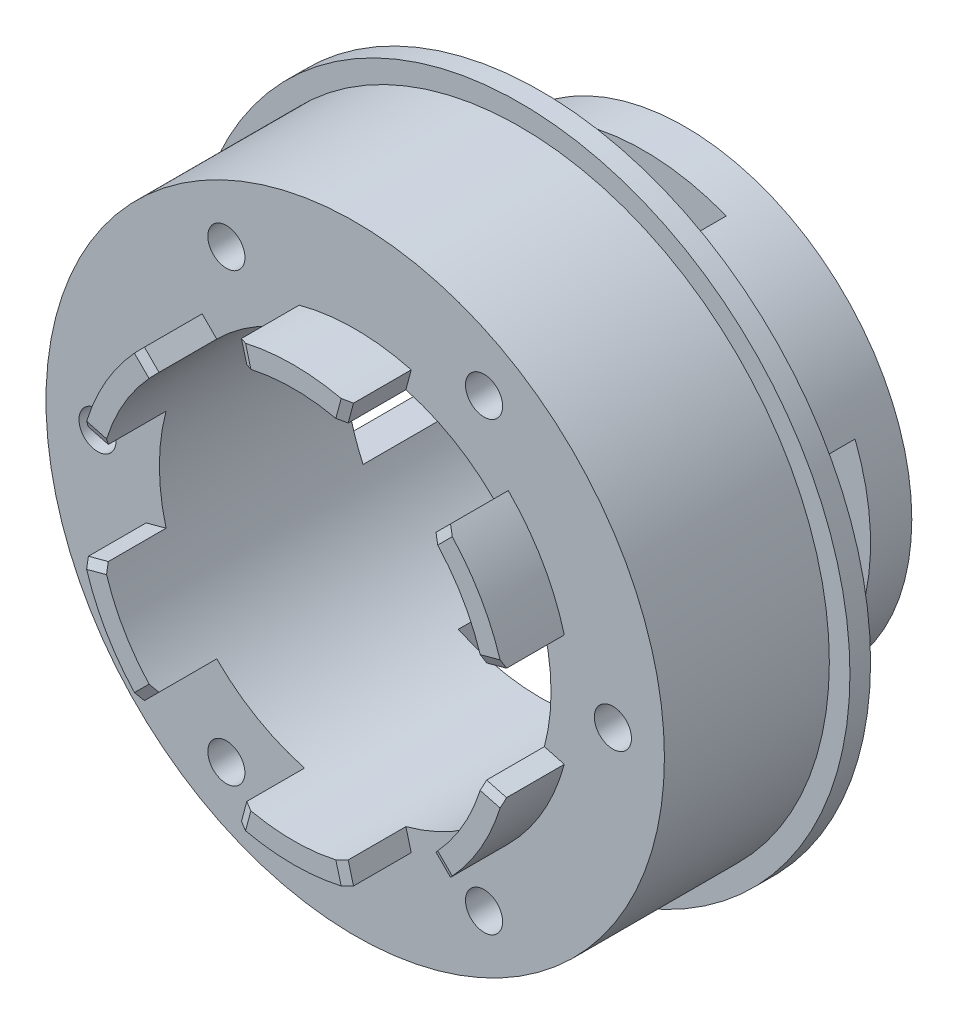
from build123d import *
from OCP.BRepFilletAPI import BRepFilletAPI_MakeChamfer

# Parameters (mm, degrees)
SKETCH_1_R               = 11
EXTRUDE_1_DEPTH          = 2
SKETCH_2_R               = 11
SKETCH_2_R_2             = 9.5
EXTRUDE_2_DEPTH          = 5
SKETCH_4_R               = 16
SKETCH_4_R_2             = 9.5
EXTRUDE_3_DEPTH          = 1
SKETCH_5_R               = 15
SKETCH_5_R_2             = 9.5
EXTRUDE_4_DEPTH          = 8
SKETCH_6_R               = 0.9
CUT_EXTRUDE_1_DEPTH      = 8
SKETCH_7_R               = 3
SKETCH_7_R_2             = 1
CUT_EXTRUDE_2_DEPTH      = 28.712812921
CUT_EXTRUDE_3_DEPTH      = 28.712812921
CUT_EXTRUDE_3_DEPTH_BACK = 28.712812921
SKETCH_8_W               = 8
SKETCH_8_H               = 5
CUT_EXTRUDE_4_DEPTH      = 28.712812921
CUT_EXTRUDE_4_DEPTH_BACK = 28.712812921
SKETCH_9_W               = 5
SKETCH_9_H               = 8
EXTRUDE_5_DEPTH          = 3
CHAMFER_1_SIZE           = 0.2
CHAMFER_1_SIZE2          = 0.410060768


with BuildPart() as part:
    # 스케치1 → 보스-돌출1 (new body)
    with BuildSketch(Plane.XY):
        Circle(SKETCH_1_R)
    extrude(amount=EXTRUDE_1_DEPTH)

    # 스케치2 → 보스-돌출2 (add)
    with BuildSketch(Plane.XY.offset(2)):
        Circle(SKETCH_2_R)
        Circle(SKETCH_2_R_2, mode=Mode.SUBTRACT)
    extrude(amount=EXTRUDE_2_DEPTH)

    # 스케치4 → 보스-돌출3 (add)
    with BuildSketch(Plane.XY.offset(7)):
        Circle(SKETCH_4_R)
        Circle(SKETCH_4_R_2, mode=Mode.SUBTRACT)
    extrude(amount=EXTRUDE_3_DEPTH)

    # 스케치5 → 보스-돌출4 (add)
    with BuildSketch(Plane.XY.offset(8)):
        Circle(SKETCH_5_R)
        Circle(SKETCH_5_R_2, mode=Mode.SUBTRACT)
    extrude(amount=EXTRUDE_4_DEPTH)

    # 스케치6 → 컷-돌출1 (cut)
    with BuildSketch(Plane.XY.offset(16)):
        with Locations((12.5, 0)):
            Circle(SKETCH_6_R)
        with Locations((6.25, -10.825317547)):
            Circle(SKETCH_6_R)
        with Locations((-6.25, -10.825317547)):
            Circle(SKETCH_6_R)
        with Locations((-12.5, 0)):
            Circle(SKETCH_6_R)
        with Locations((-6.25, 10.825317547)):
            Circle(SKETCH_6_R)
        with Locations((6.25, 10.825317547)):
            Circle(SKETCH_6_R)
    extrude(amount=-CUT_EXTRUDE_1_DEPTH, mode=Mode.SUBTRACT)

    # 스케치7 → 컷-돌출2 (cut, through all)
    with BuildSketch(Plane(origin=(0, 0, 0), x_dir=(-1, 0, 0), z_dir=(0, 0, -1))):
        Circle(SKETCH_7_R)
        with Locations((-8, 0)):
            Circle(SKETCH_7_R_2)
        with Locations((8, 0)):
            Circle(SKETCH_7_R_2)
        with Locations((0, 8)):
            Circle(SKETCH_7_R_2)
        with Locations((0, -8)):
            Circle(SKETCH_7_R_2)
    extrude(amount=-CUT_EXTRUDE_2_DEPTH, mode=Mode.SUBTRACT)

    # 스케치8 → 컷-돌출3 (cut, two sides: drawn at the far end of the back side and taken through both)
    with BuildSketch(Plane(origin=(0, 0, 0), x_dir=(1, 0, 0), z_dir=(0, 1, 0)).offset(-CUT_EXTRUDE_3_DEPTH_BACK)):
        with Locations((0, -4.5)):
            Rectangle(SKETCH_8_W, SKETCH_8_H)
    extrude(amount=CUT_EXTRUDE_3_DEPTH + CUT_EXTRUDE_3_DEPTH_BACK, mode=Mode.SUBTRACT)

    # 스케치9 → 컷-돌출4 (cut, two sides: drawn at the far end of the back side and taken through both)
    with BuildSketch(Plane(origin=(0, 0, 0), x_dir=(0, 0, -1), z_dir=(1, 0, 0)).offset(-CUT_EXTRUDE_4_DEPTH_BACK)):
        with Locations((-4.5, 0)):
            Rectangle(SKETCH_9_W, SKETCH_9_H)
    extrude(amount=CUT_EXTRUDE_4_DEPTH + CUT_EXTRUDE_4_DEPTH_BACK, mode=Mode.SUBTRACT)

    # 스케치10 → 보스-돌출5 (add)
    with BuildSketch(Plane.XY.offset(16)):
        with BuildLine():
            Line((2.458780928, 9.17629535), (2.717599974, 10.142221176))
            ThreePointArc((2.717599974, 10.142221176), (0, 10.5), (-2.717599974, 10.142221176))
            Line((-2.717599974, 10.142221176), (-2.458780928, 9.17629535))
            ThreePointArc((-2.458780928, 9.17629535), (0, 9.5), (2.458780928, 9.17629535))
        make_face()
        with BuildLine():
            Line((6.717514421, 6.717514421), (7.424621202, 7.424621202))
            ThreePointArc((7.424621202, 7.424621202), (9.09326674, 5.25), (10.142221176, 2.717599974))
            Line((10.142221176, 2.717599974), (9.17629535, 2.458780928))
            ThreePointArc((9.17629535, 2.458780928), (8.227241336, 4.75), (6.717514421, 6.717514421))
        make_face()
        with BuildLine():
            Line((9.17629535, -2.458780928), (10.142221176, -2.717599974))
            ThreePointArc((10.142221176, -2.717599974), (9.09326674, -5.25), (7.424621202, -7.424621202))
            Line((7.424621202, -7.424621202), (6.717514421, -6.717514421))
            ThreePointArc((6.717514421, -6.717514421), (8.227241336, -4.75), (9.17629535, -2.458780928))
        make_face()
        with BuildLine():
            Line((2.458780928, -9.17629535), (2.717599974, -10.142221176))
            ThreePointArc((2.717599974, -10.142221176), (0, -10.5), (-2.717599974, -10.142221176))
            Line((-2.717599974, -10.142221176), (-2.458780928, -9.17629535))
            ThreePointArc((-2.458780928, -9.17629535), (0, -9.5), (2.458780928, -9.17629535))
        make_face()
        with BuildLine():
            Line((-6.717514421, -6.717514421), (-7.424621202, -7.424621202))
            ThreePointArc((-7.424621202, -7.424621202), (-9.09326674, -5.25), (-10.142221176, -2.717599974))
            Line((-10.142221176, -2.717599974), (-9.17629535, -2.458780928))
            ThreePointArc((-9.17629535, -2.458780928), (-8.227241336, -4.75), (-6.717514421, -6.717514421))
        make_face()
        with BuildLine():
            Line((-9.17629535, 2.458780928), (-10.142221176, 2.717599974))
            ThreePointArc((-10.142221176, 2.717599974), (-9.09326674, 5.25), (-7.424621202, 7.424621202))
            Line((-7.424621202, 7.424621202), (-6.717514421, 6.717514421))
            ThreePointArc((-6.717514421, 6.717514421), (-8.227241336, 4.75), (-9.17629535, 2.458780928))
        make_face()
    extrude(amount=EXTRUDE_5_DEPTH)

    # 모따기1: one chamfer whose edges measure the first distance from different faces: ONE call of the kernel's chamfer builder (chamfer() names one face for all edges)
    chamfer_1_edges_1 = [part.edges().sort_by_distance(p)[0] for p in [
        (-7.071067812, 7.071067812, 19),
    ]]
    chamfer_1_side_1 = [part.faces().sort_by_distance(p)[0] for p in [
        (-7.071067812, 7.071067812, 17.5),
    ]]
    chamfer_1_edges_2 = [part.edges().sort_by_distance(p)[0] for p in [
        (-9.659258263, 2.588190451, 19),
    ]]
    chamfer_1_side_2 = [part.faces().sort_by_distance(p)[0] for p in [
        (-9.659258263, 2.588190451, 17.5),
    ]]
    chamfer_1_edges_3 = [part.edges().sort_by_distance(p)[0] for p in [
        (-9.659258263, -2.588190451, 19),
    ]]
    chamfer_1_side_3 = [part.faces().sort_by_distance(p)[0] for p in [
        (-9.659258263, -2.588190451, 17.5),
    ]]
    chamfer_1_edges_4 = [part.edges().sort_by_distance(p)[0] for p in [
        (-7.071067812, -7.071067812, 19),
    ]]
    chamfer_1_side_4 = [part.faces().sort_by_distance(p)[0] for p in [
        (-7.071067812, -7.071067812, 17.5),
    ]]
    chamfer_1_edges_5 = [part.edges().sort_by_distance(p)[0] for p in [
        (-2.588190451, 9.659258263, 19),
    ]]
    chamfer_1_side_5 = [part.faces().sort_by_distance(p)[0] for p in [
        (-2.588190451, 9.659258263, 17.5),
    ]]
    chamfer_1_edges_6 = [part.edges().sort_by_distance(p)[0] for p in [
        (2.588190451, 9.659258263, 19),
    ]]
    chamfer_1_side_6 = [part.faces().sort_by_distance(p)[0] for p in [
        (2.588190451, 9.659258263, 17.5),
    ]]
    chamfer_1_edges_7 = [part.edges().sort_by_distance(p)[0] for p in [
        (-2.588190451, -9.659258263, 19),
    ]]
    chamfer_1_side_7 = [part.faces().sort_by_distance(p)[0] for p in [
        (-2.588190451, -9.659258263, 17.5),
    ]]
    chamfer_1_edges_8 = [part.edges().sort_by_distance(p)[0] for p in [
        (2.588190451, -9.659258263, 19),
    ]]
    chamfer_1_side_8 = [part.faces().sort_by_distance(p)[0] for p in [
        (2.588190451, -9.659258263, 17.5),
    ]]
    chamfer_1_edges_9 = [part.edges().sort_by_distance(p)[0] for p in [
        (7.071067812, 7.071067812, 19),
    ]]
    chamfer_1_side_9 = [part.faces().sort_by_distance(p)[0] for p in [
        (7.071067812, 7.071067812, 17.5),
    ]]
    chamfer_1_edges_10 = [part.edges().sort_by_distance(p)[0] for p in [
        (9.659258263, 2.588190451, 19),
    ]]
    chamfer_1_side_10 = [part.faces().sort_by_distance(p)[0] for p in [
        (9.659258263, 2.588190451, 17.5),
    ]]
    chamfer_1_edges_11 = [part.edges().sort_by_distance(p)[0] for p in [
        (7.071067812, -7.071067812, 19),
    ]]
    chamfer_1_side_11 = [part.faces().sort_by_distance(p)[0] for p in [
        (7.071067812, -7.071067812, 17.5),
    ]]
    chamfer_1_edges_12 = [part.edges().sort_by_distance(p)[0] for p in [
        (9.659258263, -2.588190451, 19),
    ]]
    chamfer_1_side_12 = [part.faces().sort_by_distance(p)[0] for p in [
        (9.659258263, -2.588190451, 17.5),
    ]]
    chamfer_1 = BRepFilletAPI_MakeChamfer(part.part.solid().wrapped)
    for e in chamfer_1_edges_1:
        chamfer_1.Add(CHAMFER_1_SIZE, CHAMFER_1_SIZE2, e.wrapped, chamfer_1_side_1[0].wrapped)  # the first distance lies on this face
    for e in chamfer_1_edges_2:
        chamfer_1.Add(CHAMFER_1_SIZE, CHAMFER_1_SIZE2, e.wrapped, chamfer_1_side_2[0].wrapped)  # the first distance lies on this face
    for e in chamfer_1_edges_3:
        chamfer_1.Add(CHAMFER_1_SIZE, CHAMFER_1_SIZE2, e.wrapped, chamfer_1_side_3[0].wrapped)  # the first distance lies on this face
    for e in chamfer_1_edges_4:
        chamfer_1.Add(CHAMFER_1_SIZE, CHAMFER_1_SIZE2, e.wrapped, chamfer_1_side_4[0].wrapped)  # the first distance lies on this face
    for e in chamfer_1_edges_5:
        chamfer_1.Add(CHAMFER_1_SIZE, CHAMFER_1_SIZE2, e.wrapped, chamfer_1_side_5[0].wrapped)  # the first distance lies on this face
    for e in chamfer_1_edges_6:
        chamfer_1.Add(CHAMFER_1_SIZE, CHAMFER_1_SIZE2, e.wrapped, chamfer_1_side_6[0].wrapped)  # the first distance lies on this face
    for e in chamfer_1_edges_7:
        chamfer_1.Add(CHAMFER_1_SIZE, CHAMFER_1_SIZE2, e.wrapped, chamfer_1_side_7[0].wrapped)  # the first distance lies on this face
    for e in chamfer_1_edges_8:
        chamfer_1.Add(CHAMFER_1_SIZE, CHAMFER_1_SIZE2, e.wrapped, chamfer_1_side_8[0].wrapped)  # the first distance lies on this face
    for e in chamfer_1_edges_9:
        chamfer_1.Add(CHAMFER_1_SIZE, CHAMFER_1_SIZE2, e.wrapped, chamfer_1_side_9[0].wrapped)  # the first distance lies on this face
    for e in chamfer_1_edges_10:
        chamfer_1.Add(CHAMFER_1_SIZE, CHAMFER_1_SIZE2, e.wrapped, chamfer_1_side_10[0].wrapped)  # the first distance lies on this face
    for e in chamfer_1_edges_11:
        chamfer_1.Add(CHAMFER_1_SIZE, CHAMFER_1_SIZE2, e.wrapped, chamfer_1_side_11[0].wrapped)  # the first distance lies on this face
    for e in chamfer_1_edges_12:
        chamfer_1.Add(CHAMFER_1_SIZE, CHAMFER_1_SIZE2, e.wrapped, chamfer_1_side_12[0].wrapped)  # the first distance lies on this face
    add(Compound.cast(chamfer_1.Shape()), mode=Mode.REPLACE)


solid = part.part
